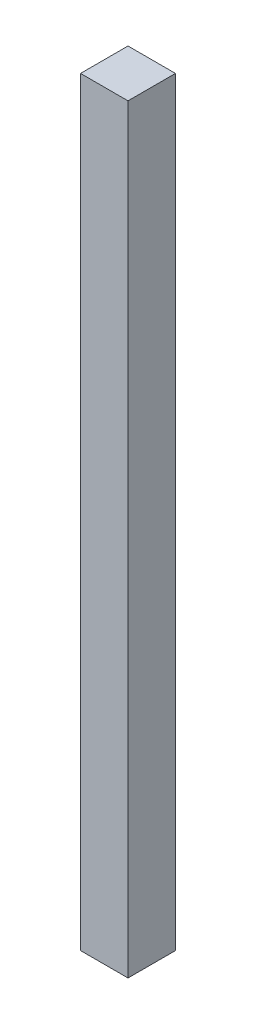
from build123d import *

# Parameters (mm, degrees)
SKETCH_1_W      = 2.5
SKETCH_1_H      = 2.5
EXTRUDE_1_DEPTH = 40


with BuildPart() as part:
    # 草图1 → 凸台-拉伸1 (new body)
    with BuildSketch(Plane(origin=(0, 0, 0), x_dir=(1, 0, 0), z_dir=(0, 1, 0))):
        with Locations((1.25, -1.25)):
            Rectangle(SKETCH_1_W, SKETCH_1_H)
    extrude(amount=EXTRUDE_1_DEPTH)


solid = part.part
